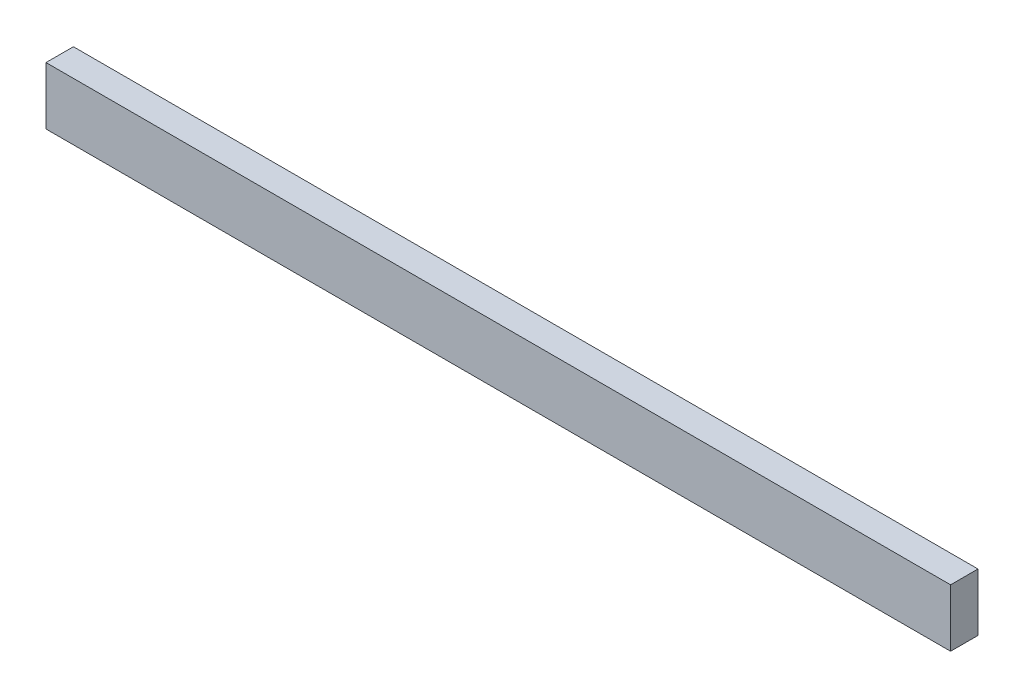
from build123d import *

# Parameters (mm, degrees)
SKETCH1_W           = 41.91
SKETCH1_H           = 2.667
BOSS_EXTRUDE1_DEPTH = 1.27


with BuildPart() as part:
    # Sketch1 → Boss-Extrude1 (new body)
    with BuildSketch(Plane.XY):
        with Locations((20.955, 1.3335)):
            Rectangle(SKETCH1_W, SKETCH1_H)
    extrude(amount=BOSS_EXTRUDE1_DEPTH)


solid = part.part
